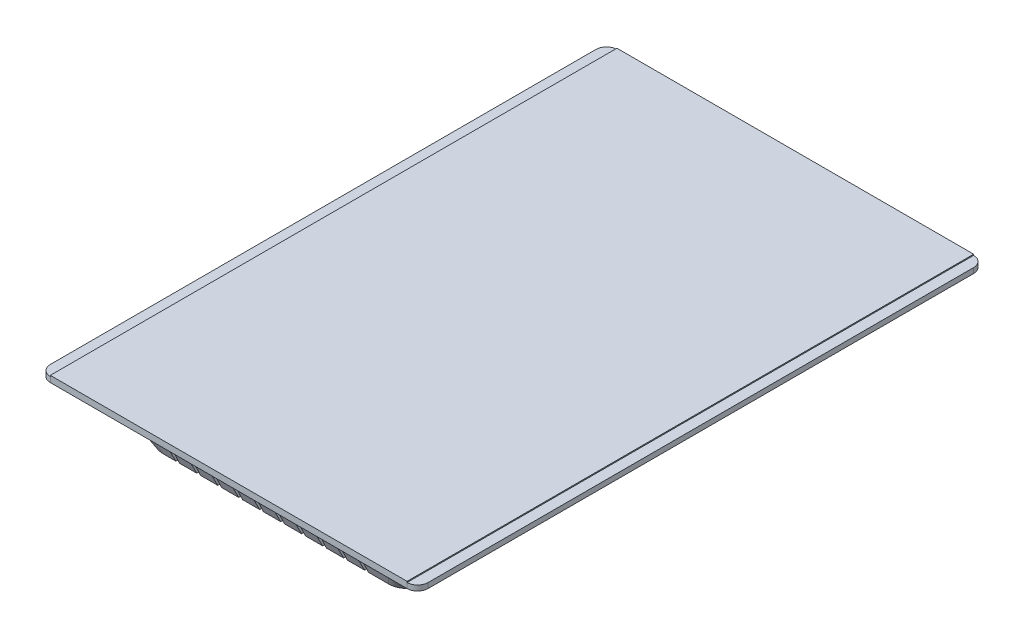
from build123d import *

# Parameters (mm, degrees)
FILLET1_R            = 20
SKETCH3_W            = 360
SKETCH3_H            = 540
BOSS_EXTRUDE1_DEPTH  = 5
FILLET2_R            = 10
SKETCH4_W            = 340
SKETCH4_H            = 540
BOSS_EXTRUDE2_DEPTH  = 1
SKETCH7_W            = 60.024727348
SKETCH7_H            = 10.999181001
SKETCH7_W_2          = 58
SKETCH7_H_2          = 9
CUT_EXTRUDE1_DEPTH   = 8
CUT_EXTRUDE2_START   = -68
SKETCH9_W            = 2.853648581
SKETCH9_H            = 8.560945743
CUT_EXTRUDE2_DEPTH   = 146
CIRPATTERN1_COUNT    = 12
CIRPATTERN1_ANGLE    = 165
CUT_EXTRUDE3_DEPTH   = 88
LPATTERN1_COUNT      = 6
LPATTERN1_PITCH      = 20
LPATTERN1_COL_COUNT  = 5
LPATTERN1_COL_PITCH  = 20
MIRROR3_COPY_1_DEPTH = 88
MIRROR3_COPY_2_DEPTH = 88
MIRROR3_COPY_3_DEPTH = 88
MIRROR3_COPY_4_DEPTH = 88
MIRROR3_COPY_5_DEPTH = 88
MIRROR3_COPY_6_DEPTH = 88
MIRROR3_COPY_7_DEPTH = 88
MIRROR3_COPY_8_DEPTH = 88
MIRROR3_COPY_9_DEPTH = 88


with BuildPart() as part:
    # Sketch1 → Loft1 section 0
    with BuildSketch(Plane(origin=(0, 0, 0), x_dir=(1, 0, 0), z_dir=(0, 1, 0))):
        with BuildLine():
            Line((150, 250), (-150, 250))
            Line((-150, 250), (-150, -250))
            Line((-150, -250), (150, -250))
            Line((150, -250), (150, 250))
        make_face()
    # Sketch2 → Loft1 section 1
    with BuildSketch(Plane(origin=(0, -50, 0), x_dir=(1, 0, 0), z_dir=(0, 1, 0))):
        with BuildLine():
            Line((-125, -225), (125, -225))
            Line((125, -225), (125, 225))
            Line((125, 225), (-125, 225))
            Line((-125, 225), (-125, -225))
        make_face()
    loft()

    # Fillet1
    fillet1_edges = [part.edges().sort_by_distance(p)[0] for p in [
        (-137.5, -25, 237.5),
        (-137.5, -25, -237.5),
        (137.5, -25, -237.5),
        (137.5, -25, 237.5),
    ]]
    fillet(fillet1_edges, radius=FILLET1_R)

    # Sketch3 → Boss-Extrude1 (add)
    with BuildSketch(Plane(origin=(0, 0, 0), x_dir=(1, 0, 0), z_dir=(0, 1, 0))):
        Rectangle(SKETCH3_W, SKETCH3_H)
    extrude(amount=BOSS_EXTRUDE1_DEPTH)

    # Fillet2
    fillet2_edges = [part.edges().sort_by_distance(p)[0] for p in [
        (-180, 2.5, -270),
        (-180, 2.5, 270),
        (180, 2.5, 270),
        (180, 2.5, -270),
    ]]
    fillet(fillet2_edges, radius=FILLET2_R)

    # Sketch4 → Boss-Extrude2 (add)
    with BuildSketch(Plane(origin=(0, 5, 0), x_dir=(1, 0, 0), z_dir=(0, 1, 0))):
        Rectangle(SKETCH4_W, SKETCH4_H)
    extrude(amount=BOSS_EXTRUDE2_DEPTH)

    # Sketch5 → Revolve2 (revolve)
    with BuildSketch(Plane(origin=(-100, 0, 0), x_dir=(0, 0, -1), z_dir=(1, 0, 0))):
        with BuildLine():
            Line((167.11145618, -70), (167.11145618, -50))
            Line((167.11145618, -50), (156.617568355, -50))
            Line((156.617568355, -50), (159.307627456, -63.736528168))
            ThreePointArc((159.307627456, -63.736528168), (162.108186695, -68.240472178), (167.11145618, -70))
        make_face()
    revolve2 = revolve(axis=Axis((-100, -50, -167.11145618), (0, -1, 0)))

    # Mirror1: Revolve2 across plane
    add(revolve2.mirror(Plane.XY))

    # Mirror2: Revolve2 across plane
    add(revolve2.mirror(Plane(origin=(0, 0, 0), x_dir=(0, 0, 1), z_dir=(1, 0, 0))))

    # Mirror2 copy 1 sketch → Mirror2 copy 1 (revolve)
    with BuildSketch(Plane.ZY.offset(-100)):
        with BuildLine():
            Line((167.11145618, -70), (167.11145618, -50))
            Line((167.11145618, -50), (156.617568355, -50))
            Line((156.617568355, -50), (159.307627456, -63.736528168))
            ThreePointArc((159.307627456, -63.736528168), (162.108186695, -68.240472178), (167.11145618, -70))
        make_face()
    revolve(axis=Axis((100, -50, 167.11145618), (0, -1, 0)))

    # Sketch7 → Revolve4 (revolve)
    with BuildSketch(Plane(origin=(0, 0, 0), x_dir=(0, 0, -1), z_dir=(1, 0, 0)), mode=Mode.PRIVATE) as revolve4_sk:
        with Locations((-156.248788272, -55.499590501)):
            Rectangle(SKETCH7_W, SKETCH7_H)
        with Locations((-156.248788272, -55.4995905)):
            Rectangle(SKETCH7_W_2, SKETCH7_H_2, mode=Mode.SUBTRACT)
    revolve(revolve4_sk.sketch.rotate(Axis((0, -60.999181001, 126.236424598), (0, 1, 0)), 180), axis=Axis((0, -60.999181001, 126.236424598), (0, 1, 0)))

    # Sketch8 → Cut-Extrude1 (cut)
    with BuildSketch(Plane.XZ.offset(60.999181001)):
        Polygon((-4.02596226, 182.897480322), (-1.949600901, 173.108919633), (0, 173.108919633), (-2.076361358, 182.897480322), align=None)
        Polygon((-19.483966138, 179.482659918), (-21.338146779, 178.880200108), (-16.338578176, 170.212356625), (-14.484397534, 170.814816436), align=None)
        Polygon((-34.984344559, 170.855727013), (-36.561604821, 169.709780356), (-29.128221581, 163.011122992), (-27.55096132, 164.15706965), align=None)
        Polygon((-47.060211585, 157.861145907), (-48.206158242, 156.283885645), (-39.066591709, 152.210125656), (-37.920645052, 153.787385918), align=None)
        Polygon((-54.529497213, 141.770916736), (-55.131957023, 139.916736095), (-45.180851649, 138.866641491), (-44.578391838, 140.720822133), align=None)
        Polygon((-56.661055724, 124.16006324), (-56.661055724, 122.210462339), (-46.872495035, 124.286823697), (-46.872495035, 126.236424598), align=None)
        Polygon((-53.24623532, 106.75245846), (-52.643775509, 104.898277819), (-43.975932027, 109.897846422), (-44.578391838, 111.752027064), align=None)
        Polygon((-44.619302415, 91.252080039), (-43.473355757, 89.674819778), (-36.774698394, 97.108203017), (-37.920645052, 98.685463279), align=None)
        Polygon((-31.624721308, 79.176213013), (-30.047461047, 78.030266356), (-25.973701058, 87.169832889), (-27.55096132, 88.315779546), align=None)
        Polygon((-15.534492138, 71.706927386), (-13.680311497, 71.104467575), (-12.630216893, 81.05557295), (-14.484397534, 81.65803276), align=None)
        Polygon((2.076361358, 69.575368874), (4.02596226, 69.575368874), (1.949600901, 79.363929563), (0, 79.363929563), align=None)
        Polygon((19.483966138, 72.990189278), (21.338146779, 73.592649089), (16.338578176, 82.260492571), (14.484397534, 81.65803276), align=None)
        Polygon((34.984344559, 81.617122183), (36.561604821, 82.763068841), (29.128221581, 89.461726204), (27.55096132, 88.315779546), align=None)
        Polygon((47.060211585, 94.61170329), (48.206158242, 96.188963551), (39.066591709, 100.26272354), (37.920645052, 98.685463279), align=None)
        Polygon((54.529497213, 110.70193246), (55.131957023, 112.556113102), (45.180851649, 113.606207705), (44.578391838, 111.752027064), align=None)
        Polygon((56.661055724, 128.312785956), (56.661055724, 130.262386858), (46.872495035, 128.186025499), (46.872495035, 126.236424598), align=None)
        Polygon((53.24623532, 145.720390736), (52.643775509, 147.574571377), (43.975932027, 142.575002774), (44.578391838, 140.720822133), align=None)
        Polygon((44.619302415, 161.220769157), (43.473355757, 162.798029419), (36.774698394, 155.364646179), (37.920645052, 153.787385918), align=None)
        Polygon((31.624721308, 173.296636183), (30.047461047, 174.44258284), (25.973701058, 165.303016308), (27.55096132, 164.15706965), align=None)
        Polygon((15.534492138, 180.765921811), (13.680311497, 181.368381621), (12.630216893, 171.417276247), (14.484397534, 170.814816436), align=None)
        Polygon((-1.949600901, 165.303016308), (0.126760457, 159.170111573), (2.076361358, 159.170111573), (0, 165.303016308), align=None)
        Polygon((0.126760457, 151.11065032), (2.076361358, 144.589341976), (4.02596226, 144.589341976), (2.076361358, 151.11065032), align=None)
        Polygon((3.720353866, 138.866641491), (5.321796475, 133.292056236), (6.865192672, 133.292056236), (5.321796475, 138.866641491), align=None)
        Polygon((14.108765321, 162.718506126), (13.511138724, 156.271286615), (15.292187772, 155.478312489), (15.889814368, 161.925532), align=None)
        Polygon((27.727597845, 153.825912619), (24.559318361, 148.179161155), (25.863855994, 146.730325334), (29.032135478, 152.377076797), align=None)
        Polygon((36.552076804, 140.16284599), (31.360968738, 136.292937202), (31.963428549, 134.438756561), (37.154536615, 138.308665349), align=None)
        Polygon((39.056369619, 124.091774585), (32.740022716, 122.667850859), (32.53623393, 120.728930075), (38.852580832, 122.152853802), align=None)
        Polygon((34.80746131, 108.391532651), (28.458029332, 109.659803335), (27.483228881, 107.971399427), (33.83266086, 106.703128743), align=None)
        Polygon((24.540026726, 95.77683465), (19.255384143, 99.518004221), (17.678123882, 98.372057563), (22.962766464, 94.630887993), align=None)
        Polygon((10.029398581, 88.428876468), (6.723308107, 93.99606272), (4.816310663, 93.5907179), (8.122401137, 88.023531649), align=None)
        Polygon((-6.215403693, 87.618186829), (-6.971288981, 94.048772681), (-8.878286425, 94.454117501), (-8.122401137, 88.023531649), align=None)
        Polygon((-21.385506203, 93.484941335), (-19.460486871, 99.667020075), (-21.037747133, 100.812966733), (-22.962766464, 94.630887993), align=None)
        Polygon((-32.857860409, 105.014724836), (-28.584789789, 109.879358887), (-29.55959024, 111.567762795), (-33.83266086, 106.703128743), align=None)
        Polygon((-38.648792046, 120.213933018), (-32.766522867, 122.919982959), (-32.970311654, 124.858903742), (-38.852580832, 122.152853802), align=None)
        Polygon((-37.756996425, 136.454484707), (-31.282626467, 136.534049919), (-30.680166657, 138.388230561), (-37.154536615, 138.308665349), align=None)
        Polygon((-30.336673111, 150.928240976), (-24.389679758, 148.367563911), (-23.085142124, 149.816399732), (-29.032135478, 152.377076797), align=None)
        Polygon((-17.670863416, 161.132557874), (-13.279535844, 156.37440286), (-11.498486797, 157.167376986), (-15.889814368, 161.925532), align=None)
        Polygon((14.044646058, 138.717845411), (16.300514667, 145.139641344), (14.723254405, 146.285588002), (12.467385797, 139.863792069), align=None)
        Polygon((18.698752422, 128.078870323), (24.298425406, 131.948246068), (23.695965596, 133.802426709), (18.096292612, 129.933050964), align=None)
        Polygon((16.210570909, 116.736143591), (23.015163514, 116.575129128), (23.617623325, 118.42930977), (16.813030719, 118.590324232), align=None)
        Polygon((7.530502285, 109.0222013), (12.940891416, 104.892298683), (14.518151677, 106.03824534), (9.107762546, 110.168147958), align=None)
        Polygon((-4.02596226, 107.88350722), (-2.076361358, 101.362198877), (-0.126760457, 101.362198877), (-2.076361358, 107.88350722), align=None)
        Polygon((-14.044646058, 113.755003785), (-16.300514667, 107.333207852), (-14.723254405, 106.187261195), (-12.467385797, 112.609057128), align=None)
        Polygon((-18.698752422, 124.393978873), (-24.298425406, 120.524603128), (-23.695965596, 118.670422487), (-18.096292612, 122.539798232), align=None)
        Polygon((-16.210570909, 135.736705606), (-23.015163514, 135.897720068), (-23.617623325, 134.043539427), (-16.813030719, 133.882524964), align=None)
        Polygon((-7.530502285, 143.450647896), (-12.940891416, 147.580550514), (-14.518151677, 146.434603856), (-9.107762546, 142.304701238), align=None)
        Polygon((8.831765652, 121.887548454), (13.65657563, 125.078047045), (13.161702648, 126.601109473), (8.354829997, 123.355405465), align=None)
        Polygon((-1.406861319, 116.49303969), (3.118431434, 112.890291005), (4.41402572, 113.831595353), (-0.158227566, 117.400225213), align=None)
        Polygon((-9.701253764, 124.563557704), (-11.729279012, 119.146437973), (-10.433684726, 118.205133625), (-8.452620011, 123.65637218), align=None)
        Polygon((-4.588843241, 134.945920907), (-10.367524527, 135.200705477), (-10.862397509, 133.677643048), (-5.065778895, 133.478063896), align=None)
    extrude(amount=-CUT_EXTRUDE1_DEPTH, mode=Mode.SUBTRACT)

    # Sketch9 → Cut-Extrude2 (cut)
    with BuildSketch(Plane(origin=(0, 0, 0), x_dir=(0, 0, -1), z_dir=(1, 0, 0)).offset(CUT_EXTRUDE2_START)):
        with Locations((-129.743739732, -55.420408636)):
            Rectangle(SKETCH9_W, SKETCH9_H)
    cut_extrude2 = extrude(amount=CUT_EXTRUDE2_DEPTH, mode=Mode.SUBTRACT)

    # CirPattern1: Cut-Extrude2 ×12 about axis
    cirpattern1_axis = Axis((0, 0, 126.236424598), (0, -1, 0))
    for i in range(1, CIRPATTERN1_COUNT):
        add(cut_extrude2.rotate(cirpattern1_axis, i * CIRPATTERN1_ANGLE / (CIRPATTERN1_COUNT - 1)), mode=Mode.SUBTRACT)

    # Sketch10 → Cut-Extrude3 (cut)
    with BuildSketch(Plane.XY.offset(-310)):
        Polygon((10.713472437, -4.043984178), (8.116709846, -50.897955335), (4.631727335, -50.897955335), (2.588639103, -4.043984178), align=None)
    cut_extrude3 = extrude(amount=CUT_EXTRUDE3_DEPTH, mode=Mode.SUBTRACT)

    # LPattern1: Cut-Extrude3 ×6
    with Locations(*[(-i * LPATTERN1_PITCH, 0, 0) for i in range(1, LPATTERN1_COUNT)]):
        add(cut_extrude3, mode=Mode.SUBTRACT)

    # LPattern1 col: Cut-Extrude3 ×5
    with Locations(*[(i * LPATTERN1_COL_PITCH, 0, 0) for i in range(1, LPATTERN1_COL_COUNT)]):
        add(cut_extrude3, mode=Mode.SUBTRACT)

    # Mirror3: Cut-Extrude3 across plane
    add(cut_extrude3.mirror(Plane.XY), mode=Mode.SUBTRACT)

    # Mirror3 copy 1 sketch → Mirror3 copy 1 (cut)
    with BuildSketch(Plane(origin=(-20, 0, 310), x_dir=(1, 0, 0), z_dir=(0, 0, -1))):
        Polygon((10.713472437, 4.043984178), (8.116709846, 50.897955335), (4.631727335, 50.897955335), (2.588639103, 4.043984178), align=None)
    extrude(amount=MIRROR3_COPY_1_DEPTH, mode=Mode.SUBTRACT)

    # Mirror3 copy 2 sketch → Mirror3 copy 2 (cut)
    with BuildSketch(Plane(origin=(-40, 0, 310), x_dir=(1, 0, 0), z_dir=(0, 0, -1))):
        Polygon((10.713472437, 4.043984178), (8.116709846, 50.897955335), (4.631727335, 50.897955335), (2.588639103, 4.043984178), align=None)
    extrude(amount=MIRROR3_COPY_2_DEPTH, mode=Mode.SUBTRACT)

    # Mirror3 copy 3 sketch → Mirror3 copy 3 (cut)
    with BuildSketch(Plane(origin=(-60, 0, 310), x_dir=(1, 0, 0), z_dir=(0, 0, -1))):
        Polygon((10.713472437, 4.043984178), (8.116709846, 50.897955335), (4.631727335, 50.897955335), (2.588639103, 4.043984178), align=None)
    extrude(amount=MIRROR3_COPY_3_DEPTH, mode=Mode.SUBTRACT)

    # Mirror3 copy 4 sketch → Mirror3 copy 4 (cut)
    with BuildSketch(Plane(origin=(-80, 0, 310), x_dir=(1, 0, 0), z_dir=(0, 0, -1))):
        Polygon((10.713472437, 4.043984178), (8.116709846, 50.897955335), (4.631727335, 50.897955335), (2.588639103, 4.043984178), align=None)
    extrude(amount=MIRROR3_COPY_4_DEPTH, mode=Mode.SUBTRACT)

    # Mirror3 copy 5 sketch → Mirror3 copy 5 (cut)
    with BuildSketch(Plane(origin=(-100, 0, 310), x_dir=(1, 0, 0), z_dir=(0, 0, -1))):
        Polygon((10.713472437, 4.043984178), (8.116709846, 50.897955335), (4.631727335, 50.897955335), (2.588639103, 4.043984178), align=None)
    extrude(amount=MIRROR3_COPY_5_DEPTH, mode=Mode.SUBTRACT)

    # Mirror3 copy 6 sketch → Mirror3 copy 6 (cut)
    with BuildSketch(Plane(origin=(20, 0, 310), x_dir=(1, 0, 0), z_dir=(0, 0, -1))):
        Polygon((10.713472437, 4.043984178), (8.116709846, 50.897955335), (4.631727335, 50.897955335), (2.588639103, 4.043984178), align=None)
    extrude(amount=MIRROR3_COPY_6_DEPTH, mode=Mode.SUBTRACT)

    # Mirror3 copy 7 sketch → Mirror3 copy 7 (cut)
    with BuildSketch(Plane(origin=(40, 0, 310), x_dir=(1, 0, 0), z_dir=(0, 0, -1))):
        Polygon((10.713472437, 4.043984178), (8.116709846, 50.897955335), (4.631727335, 50.897955335), (2.588639103, 4.043984178), align=None)
    extrude(amount=MIRROR3_COPY_7_DEPTH, mode=Mode.SUBTRACT)

    # Mirror3 copy 8 sketch → Mirror3 copy 8 (cut)
    with BuildSketch(Plane(origin=(60, 0, 310), x_dir=(1, 0, 0), z_dir=(0, 0, -1))):
        Polygon((10.713472437, 4.043984178), (8.116709846, 50.897955335), (4.631727335, 50.897955335), (2.588639103, 4.043984178), align=None)
    extrude(amount=MIRROR3_COPY_8_DEPTH, mode=Mode.SUBTRACT)

    # Mirror3 copy 9 sketch → Mirror3 copy 9 (cut)
    with BuildSketch(Plane(origin=(80, 0, 310), x_dir=(1, 0, 0), z_dir=(0, 0, -1))):
        Polygon((10.713472437, 4.043984178), (8.116709846, 50.897955335), (4.631727335, 50.897955335), (2.588639103, 4.043984178), align=None)
    extrude(amount=MIRROR3_COPY_9_DEPTH, mode=Mode.SUBTRACT)


solid = part.part
